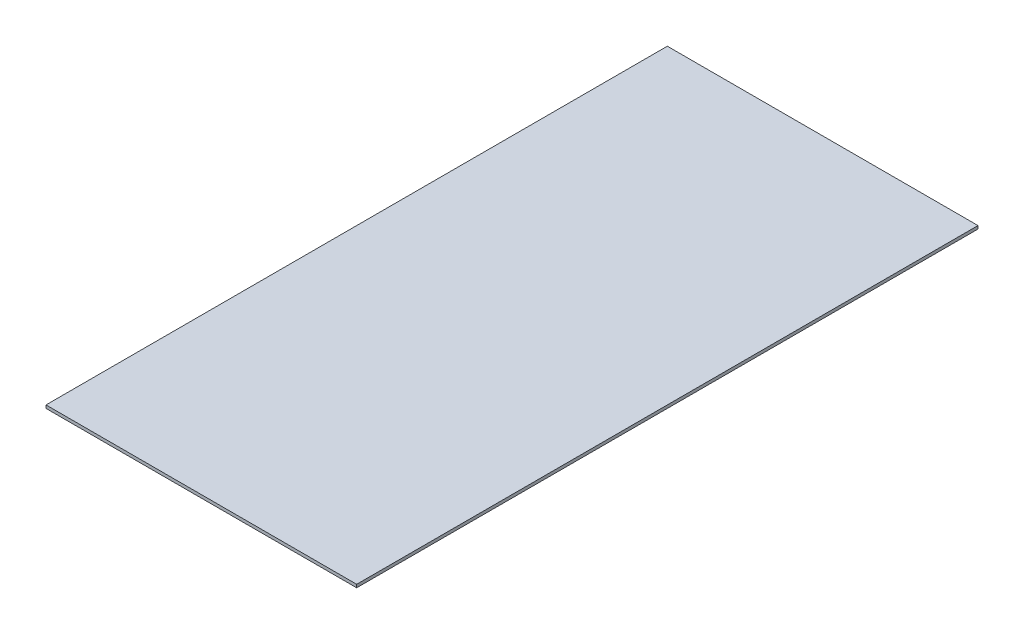
from build123d import *

# Parameters (mm, degrees)
SKETCH1_W           = 1219.2
SKETCH1_H           = 2438.4
BOSS_EXTRUDE1_DEPTH = 12


with BuildPart() as part:
    # Sketch1 → Boss-Extrude1 (new body)
    with BuildSketch(Plane(origin=(0, 0, 0), x_dir=(1, 0, 0), z_dir=(0, 1, 0))):
        with Locations((609.6, 1219.2)):
            Rectangle(SKETCH1_W, SKETCH1_H)
    extrude(amount=BOSS_EXTRUDE1_DEPTH)


solid = part.part
